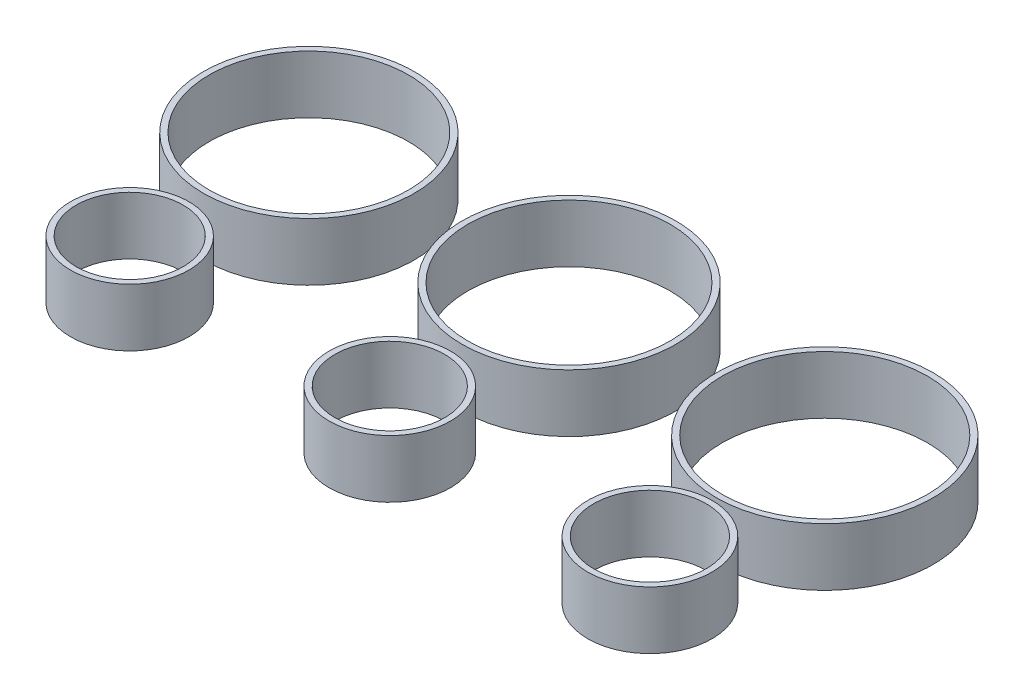
from build123d import *

# Parameters (mm, degrees)
SKETCH1_R             = 18.25
BOSS_EXTRUDE1_DEPTH   = 10
SKETCH2_R             = 17.25
CUT_EXTRUDE1_DEPTH    = 10
SKETCH3_R             = 18.5
BOSS_EXTRUDE2_DEPTH   = 10
SKETCH4_R             = 17.5
CUT_EXTRUDE2_DEPTH    = 10
SKETCH5_R             = 18.75
BOSS_EXTRUDE3_DEPTH   = 10
SKETCH6_R             = 17.75
CUT_EXTRUDE3_DEPTH    = 10
SKETCH7_R             = 10.25
BOSS_EXTRUDE4_DEPTH   = 10
SKETCH7_R_2           = 10.5
BOSS_EXTRUDE4_2_DEPTH = 10
SKETCH7_R_3           = 10.75
BOSS_EXTRUDE4_3_DEPTH = 10
SKETCH8_R             = 9.25
SKETCH8_R_2           = 9.5
SKETCH8_R_3           = 9.75
CUT_EXTRUDE5_DEPTH    = 10


with BuildPart() as part:
    # Sketch1 → Boss-Extrude1 (new body)
    with BuildSketch(Plane(origin=(0, 0, 0), x_dir=(1, 0, 0), z_dir=(0, 1, 0))):
        with Locations(Location((0, 0, 0), (0, 0, 270))):
            Circle(SKETCH1_R)
    extrude(amount=BOSS_EXTRUDE1_DEPTH)

    # Sketch2 → Cut-Extrude1 (cut)
    with BuildSketch(Plane(origin=(0, 10, 0), x_dir=(1, 0, 0), z_dir=(0, 1, 0))):
        with Locations(Location((0, 0, 0), (0, 0, 270))):
            Circle(SKETCH2_R)
    extrude(amount=-CUT_EXTRUDE1_DEPTH, mode=Mode.SUBTRACT)


with BuildPart() as body_2:
    # Sketch3 → Boss-Extrude2 (new body)
    with BuildSketch(Plane(origin=(0, 0, 0), x_dir=(1, 0, 0), z_dir=(0, 1, 0))):
        with Locations(Location((45, 0, 0), (0, 0, 270))):
            Circle(SKETCH3_R)
    extrude(amount=BOSS_EXTRUDE2_DEPTH)

    # Sketch4 → Cut-Extrude2 (cut)
    with BuildSketch(Plane(origin=(0, 10, 0), x_dir=(1, 0, 0), z_dir=(0, 1, 0))):
        with Locations(Location((45, 0, 0), (0, 0, 270))):
            Circle(SKETCH4_R)
    extrude(amount=-CUT_EXTRUDE2_DEPTH, mode=Mode.SUBTRACT)


with BuildPart() as body_3:
    # Sketch5 → Boss-Extrude3 (new body)
    with BuildSketch(Plane(origin=(0, 0, 0), x_dir=(1, 0, 0), z_dir=(0, 1, 0))):
        with Locations(Location((90, -0.740479822, 0), (0, 0, 270))):
            Circle(SKETCH5_R)
    extrude(amount=BOSS_EXTRUDE3_DEPTH)

    # Sketch6 → Cut-Extrude3 (cut)
    with BuildSketch(Plane.XZ):
        with Locations(Location((90, 0.740479822, 0), (0, 0, 270))):
            Circle(SKETCH6_R)
    extrude(amount=-CUT_EXTRUDE3_DEPTH, mode=Mode.SUBTRACT)


with BuildPart() as body_4:
    # Sketch7 → Boss-Extrude4 (new body)
    with BuildSketch(Plane(origin=(0, 0, 0), x_dir=(1, 0, 0), z_dir=(0, 1, 0))):
        with Locations(Location((0, -31, 0), (0, 0, 270))):
            Circle(SKETCH7_R)
    extrude(amount=BOSS_EXTRUDE4_DEPTH)


with BuildPart() as body_5:
    # Sketch7 → Boss-Extrude4 2 (new body)
    with BuildSketch(Plane(origin=(0, 0, 0), x_dir=(1, 0, 0), z_dir=(0, 1, 0))):
        with Locations(Location((45, -31, 0), (0, 0, 270))):
            Circle(SKETCH7_R_2)
    extrude(amount=BOSS_EXTRUDE4_2_DEPTH)


with BuildPart() as body_6:
    # Sketch7 → Boss-Extrude4 3 (new body)
    with BuildSketch(Plane(origin=(0, 0, 0), x_dir=(1, 0, 0), z_dir=(0, 1, 0))):
        with Locations(Location((90, -31, 0), (0, 0, 270))):
            Circle(SKETCH7_R_3)
    extrude(amount=BOSS_EXTRUDE4_3_DEPTH)


with BuildPart() as cut_extrude5_tool:
    # Sketch8 → Cut-Extrude5 (new body)
    with BuildSketch(Plane(origin=(0, 0, 0), x_dir=(1, 0, 0), z_dir=(0, 1, 0))):
        with Locations(Location((0, -31, 0), (0, 0, 270))):
            Circle(SKETCH8_R)
        with Locations(Location((45, -31, 0), (0, 0, 270))):
            Circle(SKETCH8_R_2)
        with Locations(Location((90, -31, 0), (0, 0, 270))):
            Circle(SKETCH8_R_3)
    extrude(amount=CUT_EXTRUDE5_DEPTH)


with BuildPart() as body_4_1:
    add(body_4.part)

    # Cut-Extrude5: cut by cut_extrude5_tool
    add(cut_extrude5_tool.part, mode=Mode.SUBTRACT)


with BuildPart() as body_5_1:
    add(body_5.part)

    # Cut-Extrude5: cut by cut_extrude5_tool
    add(cut_extrude5_tool.part, mode=Mode.SUBTRACT)


with BuildPart() as body_6_1:
    add(body_6.part)

    # Cut-Extrude5: cut by cut_extrude5_tool
    add(cut_extrude5_tool.part, mode=Mode.SUBTRACT)


solid = Compound([part.part, body_2.part, body_3.part, body_4_1.part, body_5_1.part, body_6_1.part])
